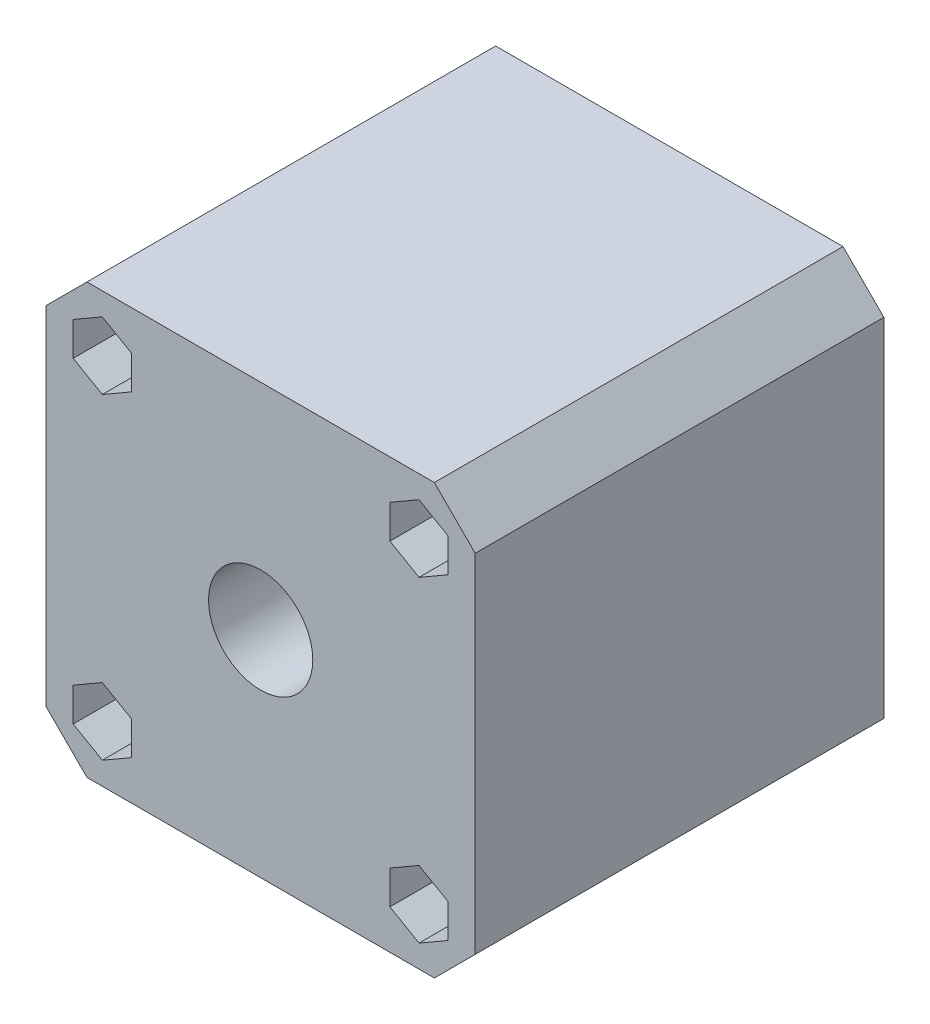
from build123d import *

# Parameters (mm, degrees)
SKETCH_1_W          = 42
SKETCH_1_H          = 42
SKETCH_1_R          = 5.1
SKETCH_1_R_2        = 1.75
EXTRUDE_1_DEPTH     = 40
CHAMFER_1_SIZE      = 4
CUT_EXTRUDE_2_DEPTH = 10
SKETCH_6_R          = 9.2
CUT_EXTRUDE_3_DEPTH = 1.2
SKETCH_7_R          = 8.1
CUT_EXTRUDE_4_DEPTH = 5.2


with BuildPart() as part:
    # 草圖1 → 填料-伸長1 (new body)
    with BuildSketch(Plane.XY):
        Rectangle(SKETCH_1_W, SKETCH_1_H)
        Circle(SKETCH_1_R, mode=Mode.SUBTRACT)
        with Locations((-15.5, 15.5)):
            Circle(SKETCH_1_R_2, mode=Mode.SUBTRACT)
        with Locations(Location((15.5, 15.5, 0), (0, 0, 180))):
            Circle(SKETCH_1_R_2, mode=Mode.SUBTRACT)
        with Locations((15.5, -15.5)):
            Circle(SKETCH_1_R_2, mode=Mode.SUBTRACT)
        with Locations(Location((-15.5, -15.5, 0), (0, 0, 180))):
            Circle(SKETCH_1_R_2, mode=Mode.SUBTRACT)
    extrude(amount=EXTRUDE_1_DEPTH)

    # 導角1
    chamfer_1_edges = [part.edges().sort_by_distance(p)[0] for p in [
        (-21, 21, 20),
        (21, 21, 20),
        (21, -21, 20),
        (-21, -21, 20),
    ]]
    chamfer(chamfer_1_edges, length=CHAMFER_1_SIZE)

    # 草圖5 → 除料-伸長2 (cut)
    with BuildSketch(Plane(origin=(0, 0, 40), x_dir=(-1, 0, 0), z_dir=(0, 0, -1))):
        Polygon((15.5, -12.209103466), (12.65, -13.854551733), (12.65, -17.145448267), (15.5, -18.790896534), (18.35, -17.145448267), (18.35, -13.854551733), align=None)
        Polygon((-15.5, -12.209103466), (-18.35, -13.854551733), (-18.35, -17.145448267), (-15.5, -18.790896534), (-12.65, -17.145448267), (-12.65, -13.854551733), align=None)
        Polygon((-15.5, 12.209103466), (-12.65, 13.854551733), (-12.65, 17.145448267), (-15.5, 18.790896534), (-18.35, 17.145448267), (-18.35, 13.854551733), align=None)
        Polygon((15.5, 12.209103466), (18.35, 13.854551733), (18.35, 17.145448267), (15.5, 18.790896534), (12.65, 17.145448267), (12.65, 13.854551733), align=None)
    extrude(amount=CUT_EXTRUDE_2_DEPTH, mode=Mode.SUBTRACT)

    # 草圖6 → 除料-伸長3 (cut)
    with BuildSketch(Plane(origin=(0, 0, 0), x_dir=(-1, 0, 0), z_dir=(0, 0, -1))):
        Circle(SKETCH_6_R)
    extrude(amount=-CUT_EXTRUDE_3_DEPTH, mode=Mode.SUBTRACT)

    # 草圖7 → 除料-伸長4 (cut)
    with BuildSketch(Plane(origin=(0, 0, 1.2), x_dir=(-1, 0, 0), z_dir=(0, 0, -1))):
        Circle(SKETCH_7_R)
    extrude(amount=-CUT_EXTRUDE_4_DEPTH, mode=Mode.SUBTRACT)


solid = part.part
